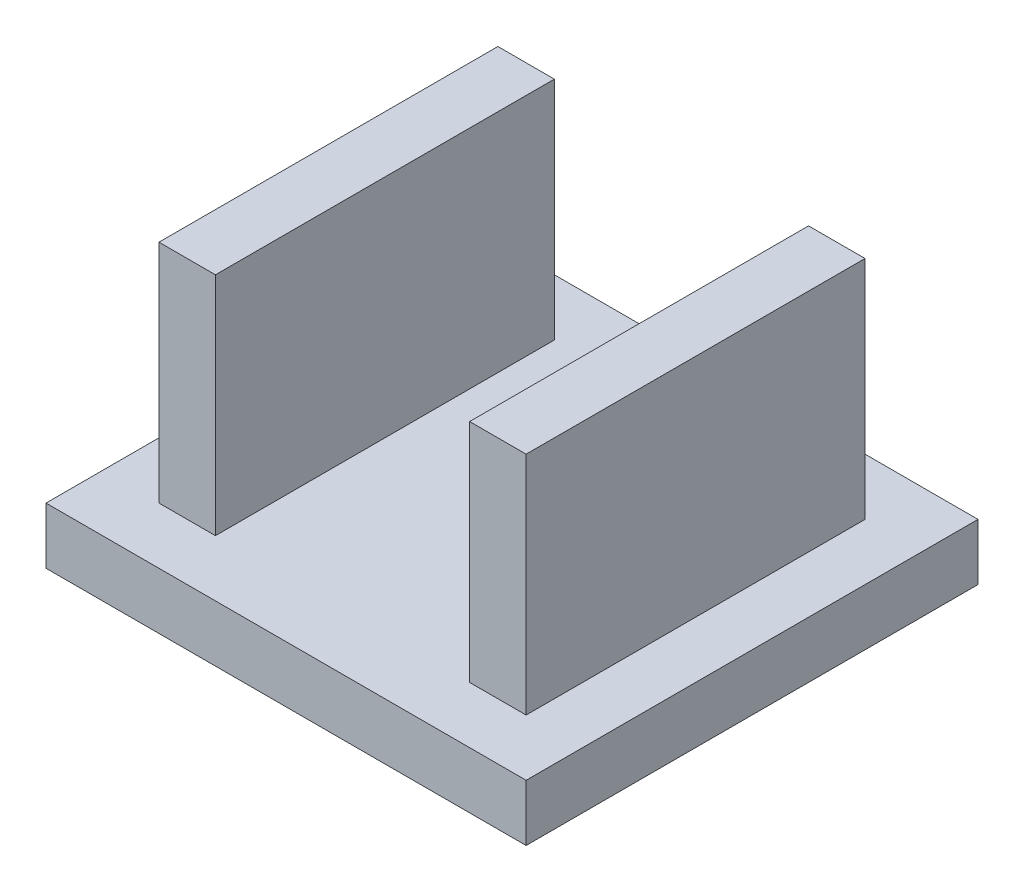
from build123d import *

# Parameters (mm, degrees)
ESBO_O1_W                = 8.5
ESBO_O1_H                = 8
RESSALTO_EXTRUS_O1_DEPTH = 1
ESBO_O2_W                = 1
ESBO_O2_H                = 6
RESSALTO_EXTRUS_O2_DEPTH = 4


with BuildPart() as part:
    # Esboço1 → Ressalto-extrusão1 (new body)
    with BuildSketch(Plane(origin=(0, 0, 0), x_dir=(1, 0, 0), z_dir=(0, 1, 0))):
        Rectangle(ESBO_O1_W, ESBO_O1_H)
    extrude(amount=RESSALTO_EXTRUS_O1_DEPTH)

    # Esboço2 → Ressalto-extrusão2 (add)
    with BuildSketch(Plane(origin=(0, 1, 0), x_dir=(1, 0, 0), z_dir=(0, 1, 0))):
        with Locations((-2.75, 0)):
            Rectangle(ESBO_O2_W, ESBO_O2_H)
        with Locations((2.75, 0)):
            Rectangle(ESBO_O2_W, ESBO_O2_H)
    extrude(amount=RESSALTO_EXTRUS_O2_DEPTH)


solid = part.part
